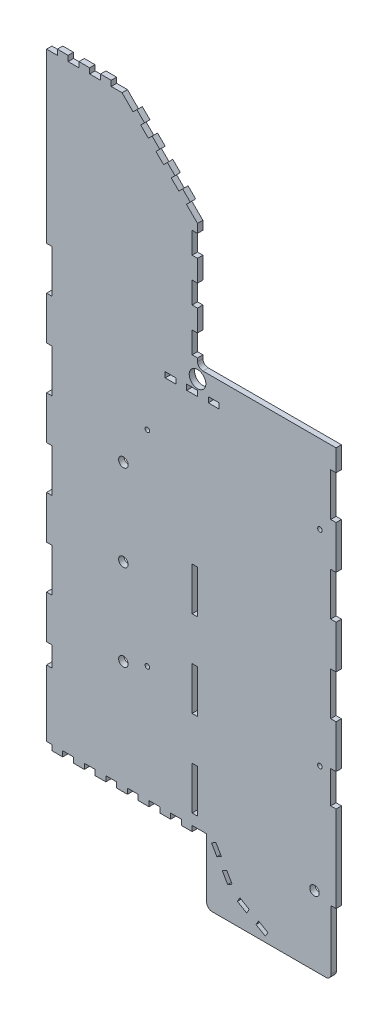
from build123d import *

# Parameters (mm, degrees)
SKETCH1_R           = 4.8895
SKETCH1_R_2         = 1.3335
SKETCH1_R_3         = 2.794
SKETCH1_W           = 3.175
SKETCH1_H           = 25.4
SKETCH1_W_2         = 6.35
SKETCH1_H_2         = 3.175
BOSS_EXTRUDE2_DEPTH = 3.175
FILLET1_R           = 3.175


with BuildPart() as part:
    # Sketch1 → Boss-Extrude2 (new body)
    with BuildSketch(Plane.XY):
        Polygon((0, 3.175), (3.175, 3.175), (3.175, 0), (9.525, 0), (9.525, 3.175), (15.875, 3.175), (15.875, 0), (22.225, 0), (22.225, 3.175), (28.575, 3.175), (28.575, 0), (34.925, 0), (34.925, 3.175), (41.275, 3.175), (41.275, 0), (47.625, 0), (47.625, 3.175), (53.975, 3.175), (53.975, 0), (60.325, 0), (60.325, 3.175), (66.675, 3.175), (66.675, 0), (73.025, 0), (73.025, 3.175), (79.375, 3.175), (79.375, 0), (85.725, 0), (85.725, 3.175), (88.9, 3.175), (94.2848, 3.175), (94.2848, -34.925), (167.535593046, -34.925), (167.535593046, 3.175), (170.4848, 3.175), (170.4848, 53.975), (167.3098, 53.975), (167.3098, 73.025), (170.4848, 73.025), (170.4848, 98.425), (167.3098, 98.425), (167.3098, 123.825), (170.4848, 123.825), (170.4848, 149.225), (167.3098, 149.225), (167.3098, 174.625), (170.4848, 174.625), (170.4848, 200.025), (167.3098, 200.025), (167.3098, 225.425), (170.4848, 225.425), (170.4848, 238.125), (88.9, 238.125), (88.9, 243.205), (85.725, 243.205), (85.725, 255.905), (88.9, 255.905), (88.9, 268.605), (85.725, 268.605), (85.725, 281.305), (88.9, 281.305), (88.9, 294.005), (85.725, 294.005), (85.725, 306.705), (88.9, 306.705), (88.9, 311.785), (82.390448212, 318.294551788), (84.635512242, 320.539615818), (80.145384182, 325.029743879), (77.900320151, 322.784679849), (73.410192091, 327.274807909), (75.655256121, 329.519871939), (71.165128061, 334.01), (68.92006403, 331.76493597), (64.42993597, 336.25506403), (66.675, 338.500128061), (62.184871939, 342.990256121), (59.939807909, 340.745192091), (55.449679849, 345.235320151), (57.694743879, 347.480384182), (53.204615818, 351.970512242), (50.959551788, 349.725448212), (44.45, 356.235), (38.1, 356.235), (38.1, 359.41), (31.75, 359.41), (31.75, 356.235), (25.4, 356.235), (25.4, 359.41), (19.05, 359.41), (19.05, 356.235), (12.7, 356.235), (12.7, 359.41), (6.35, 359.41), (6.35, 356.235), (0, 356.235), (0, 257.175), (3.175, 257.175), (3.175, 231.775), (0, 231.775), (0, 206.375), (3.175, 206.375), (3.175, 180.975), (0, 180.975), (0, 155.575), (3.175, 155.575), (3.175, 130.175), (0, 130.175), (0, 104.775), (3.175, 104.775), (3.175, 79.375), (0, 79.375), (0, 53.975), (3.175, 53.975), (3.175, 42.175), (0, 42.175), (0, 28.575), align=None)
        with Locations((88.9, 232.41)):
            Circle(SKETCH1_R, mode=Mode.SUBTRACT)
        with Locations((59.3598, 191.77)):
            Circle(SKETCH1_R_2, mode=Mode.SUBTRACT)
        with Locations((59.3598, 71.12)):
            Circle(SKETCH1_R_2, mode=Mode.SUBTRACT)
        with Locations((160.9598, 71.12)):
            Circle(SKETCH1_R_2, mode=Mode.SUBTRACT)
        with Locations((160.9598, 191.77)):
            Circle(SKETCH1_R_2, mode=Mode.SUBTRACT)
        with Locations((157.7848, 5.969)):
            Circle(SKETCH1_R_3, mode=Mode.SUBTRACT)
        with Locations((45.225, 66.574999946)):
            Circle(SKETCH1_R_3, mode=Mode.SUBTRACT)
        with Locations((45.225, 117.374999946)):
            Circle(SKETCH1_R_3, mode=Mode.SUBTRACT)
        with Locations((45.225, 168.174999946)):
            Circle(SKETCH1_R_3, mode=Mode.SUBTRACT)
        with Locations((87.3125, 123.825)):
            Rectangle(SKETCH1_W, SKETCH1_H, mode=Mode.SUBTRACT)
        Polygon((99.742302456, 1.4986), (102.917302456, -4.000661314), (100.321651116, -5.499261314), (97.146651116, 0), align=None, mode=Mode.SUBTRACT)
        with Locations((87.3125, 73.025)):
            Rectangle(SKETCH1_W, SKETCH1_H, mode=Mode.SUBTRACT)
        with Locations((87.3125, 22.225)):
            Rectangle(SKETCH1_W, SKETCH1_H, mode=Mode.SUBTRACT)
        with Locations((73.025, 225.0725)):
            Rectangle(SKETCH1_W_2, SKETCH1_H_2, mode=Mode.SUBTRACT)
        with Locations((85.725, 225.0725)):
            Rectangle(SKETCH1_W_2, SKETCH1_H_2, mode=Mode.SUBTRACT)
        with Locations((98.425, 225.0725)):
            Rectangle(SKETCH1_W_2, SKETCH1_H_2, mode=Mode.SUBTRACT)
        Polygon((106.092302456, -9.499922628), (103.496651116, -10.998522628), (106.671651116, -16.497783942), (109.267302456, -14.999183942), align=None, mode=Mode.SUBTRACT)
        Polygon((113.854167186, -19.62934866), (112.355567186, -22.225), (117.8548285, -25.4), (119.3534285, -22.80434866), align=None, mode=Mode.SUBTRACT)
        Polygon((124.852689814, -25.97934866), (123.354089814, -28.575), (128.853351128, -31.75), (130.351951128, -29.15434866), align=None, mode=Mode.SUBTRACT)
    extrude(amount=BOSS_EXTRUDE2_DEPTH)

    # Fillet1
    fillet1_edges = [part.edges().sort_by_distance(p)[0] for p in [
        (88.9, 238.125, 1.5875),
        (167.535593046, -34.925, 1.5875),
        (94.2848, -34.925, 1.5875),
    ]]
    fillet(fillet1_edges, radius=FILLET1_R)


solid = part.part
